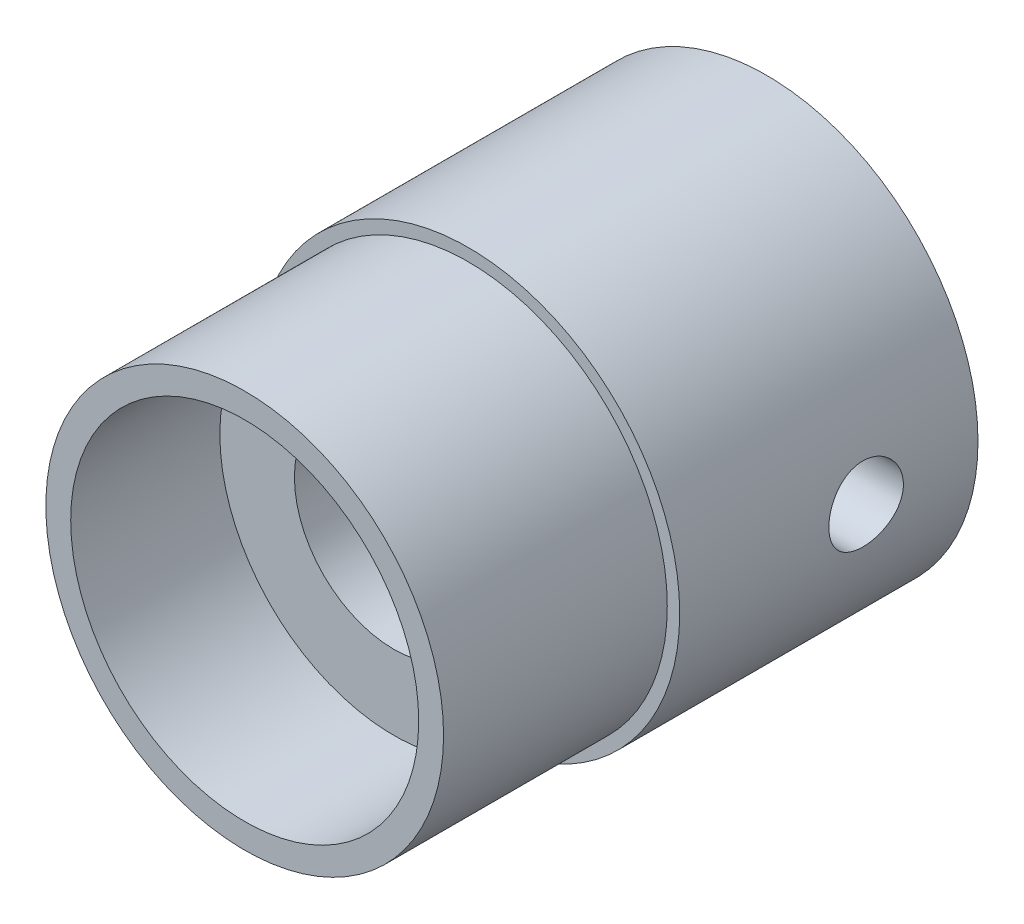
from build123d import *

# Parameters (mm, degrees)
SKETCH1_R                = 7.5
SKETCH1_R_2              = 4
BOSS_EXTRUDE1_DEPTH      = 3
SKETCH2_R                = 8.5
SKETCH2_R_2              = 5.5
BOSS_EXTRUDE2_DEPTH      = 12
CUT_EXTRUDE1_DEPTH       = 17.985287751
CUT_EXTRUDE1_DEPTH_BACK  = 17.985287751
SKETCH4_R                = 1.5
BOSS_EXTRUDE4_DEPTH      = 6
BOSS_EXTRUDE4_DEPTH_BACK = 3
SKETCH5_R                = 8
SKETCH5_R_2              = 7


with BuildPart() as part:
    # Sketch1 → Boss-Extrude1 (new body)
    with BuildSketch(Plane.XY):
        Circle(SKETCH1_R)
        Circle(SKETCH1_R_2, mode=Mode.SUBTRACT)
    extrude(amount=BOSS_EXTRUDE1_DEPTH)

    # Sketch2 → Boss-Extrude2 (add)
    with BuildSketch(Plane.XY):
        Circle(SKETCH2_R)
        Circle(SKETCH2_R_2, mode=Mode.SUBTRACT)
    extrude(amount=-BOSS_EXTRUDE2_DEPTH)

    # Sketch4 → Cut-Extrude1 (cut, two sides: drawn at the far end of the back side and taken through both)
    with BuildSketch(Plane(origin=(0, 0, 0), x_dir=(0, 0, -1), z_dir=(1, 0, 0)).offset(-CUT_EXTRUDE1_DEPTH_BACK)):
        with Locations((7.5, 0)):
            Circle(SKETCH4_R)
    extrude(amount=CUT_EXTRUDE1_DEPTH + CUT_EXTRUDE1_DEPTH_BACK, mode=Mode.SUBTRACT)

    # Sketch5 → Boss-Extrude4 (add, two sides: drawn at the far end of the back side and taken through both)
    with BuildSketch(Plane.XY.offset(3).offset(-BOSS_EXTRUDE4_DEPTH_BACK)):
        Circle(SKETCH5_R)
        Circle(SKETCH5_R_2, mode=Mode.SUBTRACT)
    extrude(amount=BOSS_EXTRUDE4_DEPTH + BOSS_EXTRUDE4_DEPTH_BACK)


solid = part.part
